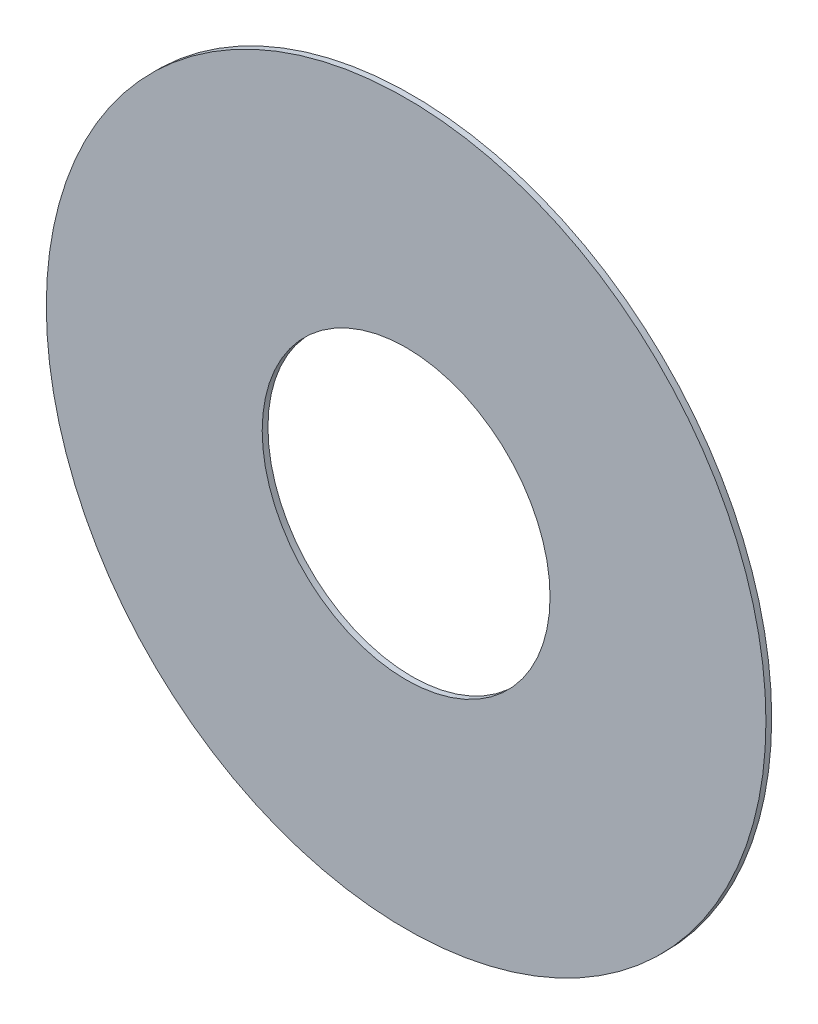
from build123d import *

# Parameters (mm, degrees)
SKETCH1_R           = 12.5
SKETCH1_R_2         = 5
BOSS_EXTRUDE2_DEPTH = 0.2
SCALE1_SCALE        = 1.9329
SCALE2_SCALE        = 1.5


with BuildPart() as part:
    # Sketch1 → Boss-Extrude2 (new body)
    with BuildSketch(Plane.XY):
        Circle(SKETCH1_R)
        Circle(SKETCH1_R_2, mode=Mode.SUBTRACT)
    extrude(amount=BOSS_EXTRUDE2_DEPTH)


with BuildPart() as part_1:
    # Scale1: scaled about (0, 0, 0.1)
    add(part.part.scale(SCALE1_SCALE).moved(Location((0, 0, -0.09329))))


with BuildPart() as part_2:
    # Scale2: scaled about (0, 0, 0.1)
    add(part_1.part.scale(SCALE2_SCALE).moved(Location((0, 0, -0.05))))


solid = part_2.part
